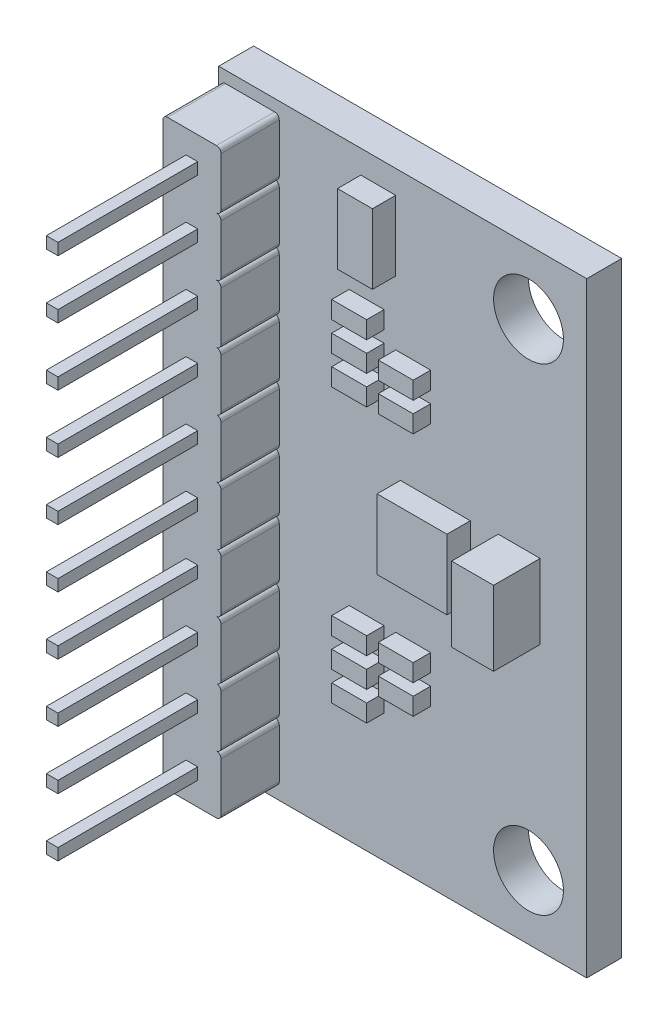
from build123d import *

# Parameters (mm, degrees)
SKETCH1_W                = 15.8
SKETCH1_H                = 26
SKETCH1_R                = 1.5
BOSS_EXTRUDE1_DEPTH      = 1.5
BOSS_EXTRUDE2_DEPTH      = 2.5
BOSS_EXTRUDE3_DEPTH      = 6
BOSS_EXTRUDE3_DEPTH_BACK = 5
SKETCH3_W                = 0.5
SKETCH3_H                = 0.5
SKETCH4_W                = 3
SKETCH4_H                = 3
SKETCH4_W_2              = 1.5
BOSS_EXTRUDE4_DEPTH      = 1
SKETCH5_W                = 1.8
SKETCH5_H                = 3.2
BOSS_EXTRUDE5_DEPTH      = 2
SKETCH6_W                = 1.5
SKETCH6_H                = 0.75
BOSS_EXTRUDE6_DEPTH      = 0.75


with BuildPart() as part:
    # Sketch1 → Boss-Extrude1 (new body)
    with BuildSketch(Plane.XY):
        Rectangle(SKETCH1_W, SKETCH1_H)
        with Locations((5.4, 10.25)):
            Circle(SKETCH1_R, mode=Mode.SUBTRACT)
        with Locations((5.4, -10.25)):
            Circle(SKETCH1_R, mode=Mode.SUBTRACT)
    extrude(amount=BOSS_EXTRUDE1_DEPTH)

    # Sketch2 → Boss-Extrude2 (add)
    with BuildSketch(Plane.XY.offset(1.5)):
        with BuildLine():
            Line((-7.8, 10.2), (-7.8, 12.3))
            ThreePointArc((-7.8, 12.3), (-7.741421356, 12.441421356), (-7.6, 12.5))
            Line((-7.6, 12.5), (-5.5, 12.5))
            ThreePointArc((-5.5, 12.5), (-5.358578644, 12.441421356), (-5.3, 12.3))
            Line((-5.3, 12.3), (-5.3, 10.2))
            ThreePointArc((-5.3, 10.2), (-5.358578644, 10.058578644), (-5.5, 10))
            ThreePointArc((-5.5, 10), (-5.358578644, 9.941421356), (-5.3, 9.8))
            Line((-5.3, 9.8), (-5.3, 7.7))
            ThreePointArc((-5.3, 7.7), (-5.358578644, 7.558578644), (-5.5, 7.5))
            ThreePointArc((-5.5, 7.5), (-5.358578644, 7.441421356), (-5.3, 7.3))
            Line((-5.3, 7.3), (-5.3, 5.2))
            ThreePointArc((-5.3, 5.2), (-5.358578644, 5.058578644), (-5.5, 5))
            ThreePointArc((-5.5, 5), (-5.358578644, 4.941421356), (-5.3, 4.8))
            Line((-5.3, 4.8), (-5.3, 2.7))
            ThreePointArc((-5.3, 2.7), (-5.358578644, 2.558578644), (-5.5, 2.5))
            ThreePointArc((-5.5, 2.5), (-5.358578644, 2.441421356), (-5.3, 2.3))
            Line((-5.3, 2.3), (-5.3, 0.2))
            ThreePointArc((-5.3, 0.2), (-5.358578644, 0.058578644), (-5.5, 0))
            ThreePointArc((-5.5, 0), (-5.358578644, -0.058578644), (-5.3, -0.2))
            Line((-5.3, -0.2), (-5.3, -2.3))
            ThreePointArc((-5.3, -2.3), (-5.358578644, -2.441421356), (-5.5, -2.5))
            ThreePointArc((-5.5, -2.5), (-5.358578644, -2.558578644), (-5.3, -2.7))
            Line((-5.3, -2.7), (-5.3, -4.8))
            ThreePointArc((-5.3, -4.8), (-5.358578644, -4.941421356), (-5.5, -5))
            ThreePointArc((-5.5, -5), (-5.358578644, -5.058578644), (-5.3, -5.2))
            Line((-5.3, -5.2), (-5.3, -7.3))
            ThreePointArc((-5.3, -7.3), (-5.358578644, -7.441421356), (-5.5, -7.5))
            ThreePointArc((-5.5, -7.5), (-5.358578644, -7.558578644), (-5.3, -7.7))
            Line((-5.3, -7.7), (-5.3, -9.8))
            ThreePointArc((-5.3, -9.8), (-5.358578644, -9.941421356), (-5.5, -10))
            ThreePointArc((-5.5, -10), (-5.358578644, -10.058578644), (-5.3, -10.2))
            Line((-5.3, -10.2), (-5.3, -12.3))
            ThreePointArc((-5.3, -12.3), (-5.358578644, -12.441421356), (-5.5, -12.5))
            Line((-5.5, -12.5), (-7.6, -12.5))
            ThreePointArc((-7.6, -12.5), (-7.741421356, -12.441421356), (-7.8, -12.3))
            Line((-7.8, -12.3), (-7.8, -10.2))
            ThreePointArc((-7.8, -10.2), (-7.741421356, -10.058578644), (-7.6, -10))
            ThreePointArc((-7.6, -10), (-7.741421356, -9.941421356), (-7.8, -9.8))
            Line((-7.8, -9.8), (-7.8, -7.7))
            ThreePointArc((-7.8, -7.7), (-7.741421356, -7.558578644), (-7.6, -7.5))
            ThreePointArc((-7.6, -7.5), (-7.741421356, -7.441421356), (-7.8, -7.3))
            Line((-7.8, -7.3), (-7.8, -5.2))
            ThreePointArc((-7.8, -5.2), (-7.741421356, -5.058578644), (-7.6, -5))
            ThreePointArc((-7.6, -5), (-7.741421356, -4.941421356), (-7.8, -4.8))
            Line((-7.8, -4.8), (-7.8, -2.7))
            ThreePointArc((-7.8, -2.7), (-7.741421356, -2.558578644), (-7.6, -2.5))
            ThreePointArc((-7.6, -2.5), (-7.741421356, -2.441421356), (-7.8, -2.3))
            Line((-7.8, -2.3), (-7.8, -0.2))
            ThreePointArc((-7.8, -0.2), (-7.741421356, -0.058578644), (-7.6, 0))
            ThreePointArc((-7.6, 0), (-7.741421356, 0.058578644), (-7.8, 0.2))
            Line((-7.8, 0.2), (-7.8, 2.3))
            ThreePointArc((-7.8, 2.3), (-7.741421356, 2.441421356), (-7.6, 2.5))
            ThreePointArc((-7.6, 2.5), (-7.741421356, 2.558578644), (-7.8, 2.7))
            Line((-7.8, 2.7), (-7.8, 4.8))
            ThreePointArc((-7.8, 4.8), (-7.741421356, 4.941421356), (-7.6, 5))
            ThreePointArc((-7.6, 5), (-7.741421356, 5.058578644), (-7.8, 5.2))
            Line((-7.8, 5.2), (-7.8, 7.3))
            ThreePointArc((-7.8, 7.3), (-7.741421356, 7.441421356), (-7.6, 7.5))
            ThreePointArc((-7.6, 7.5), (-7.741421356, 7.558578644), (-7.8, 7.7))
            Line((-7.8, 7.7), (-7.8, 9.8))
            ThreePointArc((-7.8, 9.8), (-7.741421356, 9.941421356), (-7.6, 10))
            ThreePointArc((-7.6, 10), (-7.741421356, 10.058578644), (-7.8, 10.2))
        make_face()
    extrude(amount=BOSS_EXTRUDE2_DEPTH)

    # Sketch3 → Boss-Extrude3 (add, two sides: drawn at the far end of the back side and taken through both)
    with BuildSketch(Plane.XY.offset(4).offset(-BOSS_EXTRUDE3_DEPTH_BACK)):
        with Locations((-6.55, 11.25)):
            Rectangle(SKETCH3_W, SKETCH3_H)
        with Locations((-6.55, 8.75)):
            Rectangle(SKETCH3_W, SKETCH3_H)
        with Locations((-6.55, 6.25)):
            Rectangle(SKETCH3_W, SKETCH3_H)
        with Locations((-6.55, 3.75)):
            Rectangle(SKETCH3_W, SKETCH3_H)
        with Locations((-6.55, 1.25)):
            Rectangle(SKETCH3_W, SKETCH3_H)
        with Locations((-6.55, -1.25)):
            Rectangle(SKETCH3_W, SKETCH3_H)
        with Locations((-6.55, -3.75)):
            Rectangle(SKETCH3_W, SKETCH3_H)
        with Locations((-6.55, -6.25)):
            Rectangle(SKETCH3_W, SKETCH3_H)
        with Locations((-6.55, -8.75)):
            Rectangle(SKETCH3_W, SKETCH3_H)
        with Locations((-6.55, -11.25)):
            Rectangle(SKETCH3_W, SKETCH3_H)
    extrude(amount=BOSS_EXTRUDE3_DEPTH + BOSS_EXTRUDE3_DEPTH_BACK)

    # Sketch4 → Boss-Extrude4 (add)
    with BuildSketch(Plane.XY.offset(1.5)):
        with Locations((1.4, 0)):
            Rectangle(SKETCH4_W, SKETCH4_H)
        with Locations((-1.05, 10.5)):
            Rectangle(SKETCH4_W_2, SKETCH4_H)
    extrude(amount=BOSS_EXTRUDE4_DEPTH)

    # Sketch5 → Boss-Extrude5 (add)
    with BuildSketch(Plane.XY.offset(1.5)):
        with Locations((5, 0)):
            Rectangle(SKETCH5_W, SKETCH5_H)
    extrude(amount=BOSS_EXTRUDE5_DEPTH)

    # Sketch6 → Boss-Extrude6 (add)
    with BuildSketch(Plane.XY.offset(1.5)):
        with Locations((-1.55, 7.125)):
            Rectangle(SKETCH6_W, SKETCH6_H)
        with Locations((-1.55, 5.875)):
            Rectangle(SKETCH6_W, SKETCH6_H)
        with Locations((-1.55, 4.625)):
            Rectangle(SKETCH6_W, SKETCH6_H)
        with Locations((0.45, 5.875)):
            Rectangle(SKETCH6_W, SKETCH6_H)
        with Locations((0.45, 4.625)):
            Rectangle(SKETCH6_W, SKETCH6_H)
        with Locations((0.45, -4.625)):
            Rectangle(SKETCH6_W, SKETCH6_H)
        with Locations((0.45, -5.875)):
            Rectangle(SKETCH6_W, SKETCH6_H)
        with Locations((-1.55, -4.625)):
            Rectangle(SKETCH6_W, SKETCH6_H)
        with Locations((-1.55, -5.875)):
            Rectangle(SKETCH6_W, SKETCH6_H)
        with Locations((-1.55, -7.125)):
            Rectangle(SKETCH6_W, SKETCH6_H)
    extrude(amount=BOSS_EXTRUDE6_DEPTH)


solid = part.part
